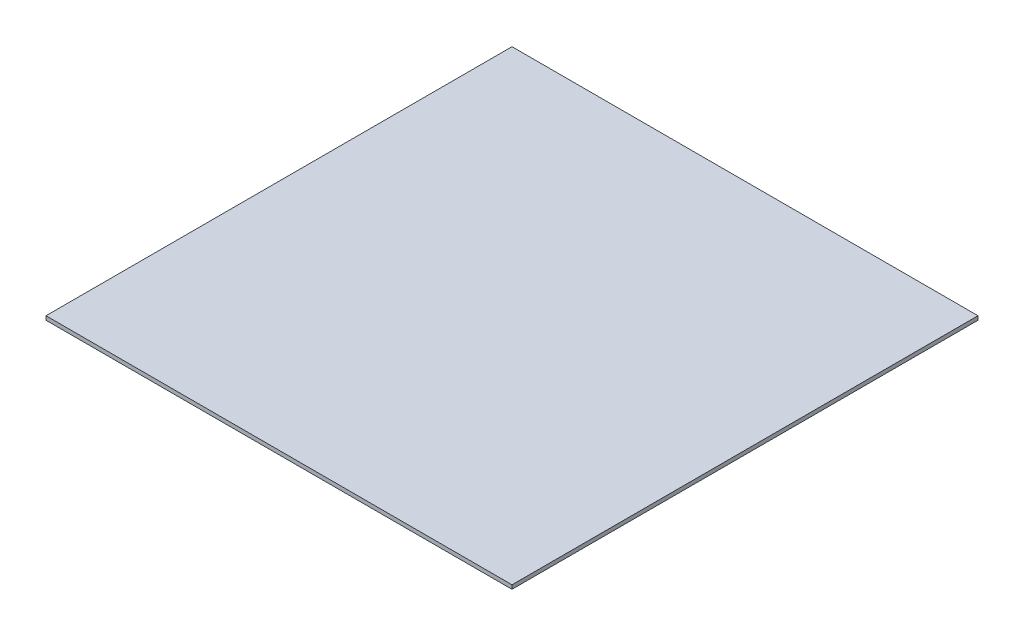
from build123d import *

# Parameters (mm, degrees)
SKETCH1_W           = 189.6
SKETCH1_H           = 189.6
BOSS_EXTRUDE1_DEPTH = 0.8


with BuildPart() as part:
    # Sketch1 → Boss-Extrude1 (new, symmetric)
    with BuildSketch(Plane(origin=(0, 0, 0), x_dir=(1, 0, 0), z_dir=(0, 1, 0))):
        Rectangle(SKETCH1_W, SKETCH1_H)
    extrude(amount=BOSS_EXTRUDE1_DEPTH, both=True)


solid = part.part
